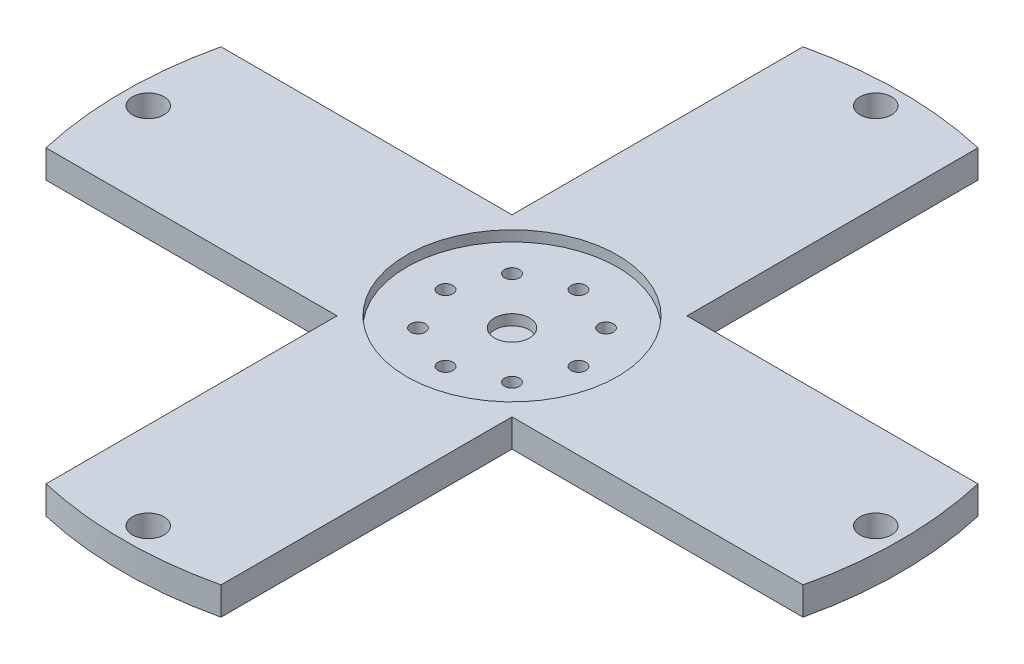
from build123d import *

# Parameters (mm, degrees)
SKETCH_1_R          = 2.1
SKETCH_1_R_2        = 4.5
EXTRUDE_1_DEPTH     = 8
SKETCH_2_R          = 30.120830341
CUT_EXTRUDE_1_DEPTH = 3
SKETCH_3_R          = 5
CUT_EXTRUDE_2_DEPTH = 3


with BuildPart() as part:
    # 草图1 → 凸台-拉伸1 (new body)
    with BuildSketch(Plane(origin=(0, 0, 0), x_dir=(1, 0, 0), z_dir=(0, 1, 0))):
        with BuildLine():
            Line((-25, 108.148046677), (-25, 25))
            Line((-25, 25), (-108.148046677, 25))
            ThreePointArc((-108.148046677, 25), (-111, 0), (-108.148046677, -25))
            Line((-108.148046677, -25), (-25, -25))
            Line((-25, -25), (-25, -108.148046677))
            ThreePointArc((-25, -108.148046677), (0, -111), (25, -108.148046677))
            Line((25, -108.148046677), (25, -25))
            Line((25, -25), (108.148046677, -25))
            ThreePointArc((108.148046677, -25), (111, 0), (108.148046677, 25))
            Line((108.148046677, 25), (25, 25))
            Line((25, 25), (25, 108.148046677))
            ThreePointArc((25, 108.148046677), (0, 111), (-25, 108.148046677))
        make_face()
        with Locations(Location((0, 19, 0), (0, 0, 270))):
            Circle(SKETCH_1_R, mode=Mode.SUBTRACT)
        with Locations(Location((13.435028843, 13.435028843, 0), (0, 0, 270))):
            Circle(SKETCH_1_R, mode=Mode.SUBTRACT)
        with Locations(Location((19, 0, 0), (0, 0, 270))):
            Circle(SKETCH_1_R, mode=Mode.SUBTRACT)
        with Locations(Location((13.435028843, -13.435028843, 0), (0, 0, 270))):
            Circle(SKETCH_1_R, mode=Mode.SUBTRACT)
        with Locations(Location((0, -19, 0), (0, 0, 270))):
            Circle(SKETCH_1_R, mode=Mode.SUBTRACT)
        with Locations(Location((-13.435028843, -13.435028843, 0), (0, 0, 270))):
            Circle(SKETCH_1_R, mode=Mode.SUBTRACT)
        with Locations(Location((-19, 0, 0), (0, 0, 270))):
            Circle(SKETCH_1_R, mode=Mode.SUBTRACT)
        with Locations(Location((-13.435028843, 13.435028843, 0), (0, 0, 270))):
            Circle(SKETCH_1_R, mode=Mode.SUBTRACT)
        with Locations(Location((0, 103.945, 0), (0, 0, 270))):
            Circle(SKETCH_1_R_2, mode=Mode.SUBTRACT)
        with Locations(Location((103.945, 0, 0), (0, 0, 270))):
            Circle(SKETCH_1_R_2, mode=Mode.SUBTRACT)
        with Locations(Location((0, -103.945, 0), (0, 0, 270))):
            Circle(SKETCH_1_R_2, mode=Mode.SUBTRACT)
        with Locations(Location((-103.945, 0, 0), (0, 0, 270))):
            Circle(SKETCH_1_R_2, mode=Mode.SUBTRACT)
    extrude(amount=EXTRUDE_1_DEPTH)

    # 草图2 → 切除-拉伸1 (cut)
    with BuildSketch(Plane(origin=(0, 8, 0), x_dir=(1, 0, 0), z_dir=(0, 1, 0))):
        with Locations(Location((0, 0, 0), (0, 0, 270))):
            Circle(SKETCH_2_R)
    extrude(amount=-CUT_EXTRUDE_1_DEPTH, mode=Mode.SUBTRACT)

    # 草图3 → 切除-拉伸2 (cut)
    with BuildSketch(Plane(origin=(0, 5, 0), x_dir=(1, 0, 0), z_dir=(0, 1, 0))):
        with Locations(Location((0, 0, 0), (0, 0, 270))):
            Circle(SKETCH_3_R)
    extrude(amount=-CUT_EXTRUDE_2_DEPTH, mode=Mode.SUBTRACT)


solid = part.part
